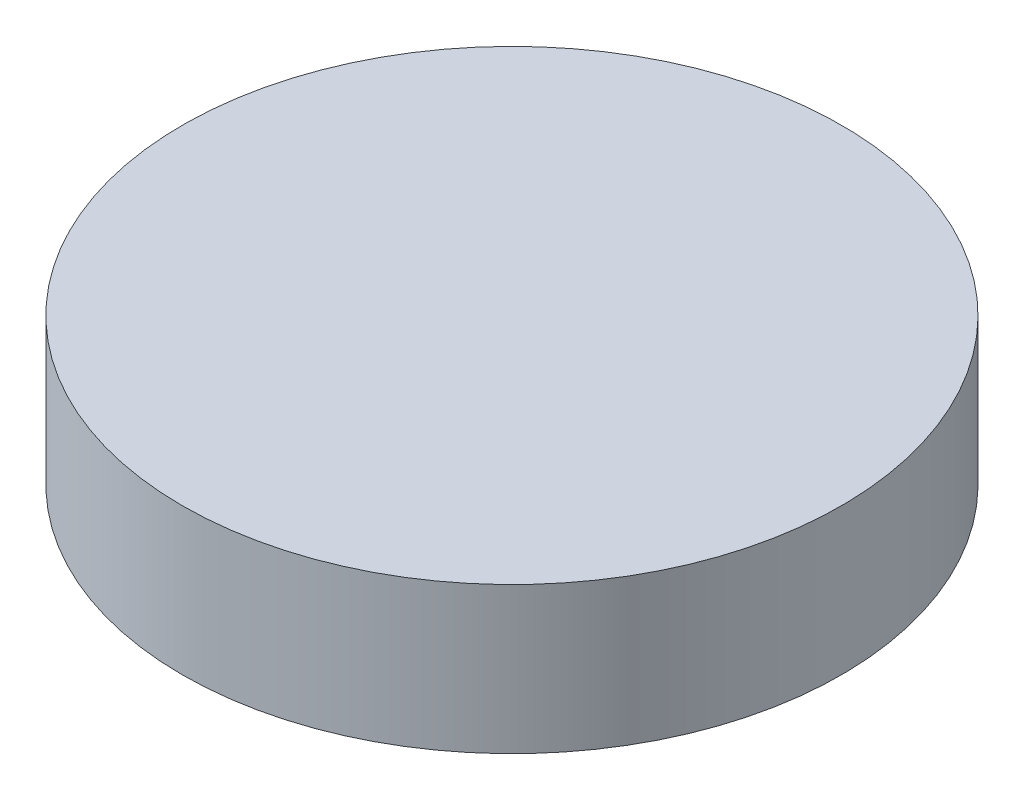
from build123d import *

# Parameters (mm, degrees)
SKETCH2_R           = 90
BOSS_EXTRUDE1_DEPTH = 40
SKETCH4_R           = 25
BOSS_EXTRUDE2_DEPTH = 5
SKETCH6_R           = 20
BOSS_EXTRUDE3_DEPTH = 40


with BuildPart() as part:
    # Sketch2 → Boss-Extrude1 (new body)
    with BuildSketch(Plane(origin=(0, 0, 0), x_dir=(1, 0, 0), z_dir=(0, 1, 0))):
        with Locations(Location((0, 0, 0), (0, 0, 270))):
            Circle(SKETCH2_R)
    extrude(amount=BOSS_EXTRUDE1_DEPTH)

    # Sketch4 → Boss-Extrude2 (add)
    with BuildSketch(Plane(origin=(0, 0, 0), x_dir=(-1, 0, 0), z_dir=(0, -1, 0))):
        with Locations(Location((0, 0, 0), (0, 0, 90))):
            Circle(SKETCH4_R)
    extrude(amount=BOSS_EXTRUDE2_DEPTH)

    # Sketch6 → Boss-Extrude3 (add)
    with BuildSketch(Plane(origin=(0, -5, 0), x_dir=(-1, 0, 0), z_dir=(0, -1, 0))):
        with Locations(Location((0, 0, 0), (0, 0, 90))):
            Circle(SKETCH6_R)
    extrude(amount=BOSS_EXTRUDE3_DEPTH)


solid = part.part
